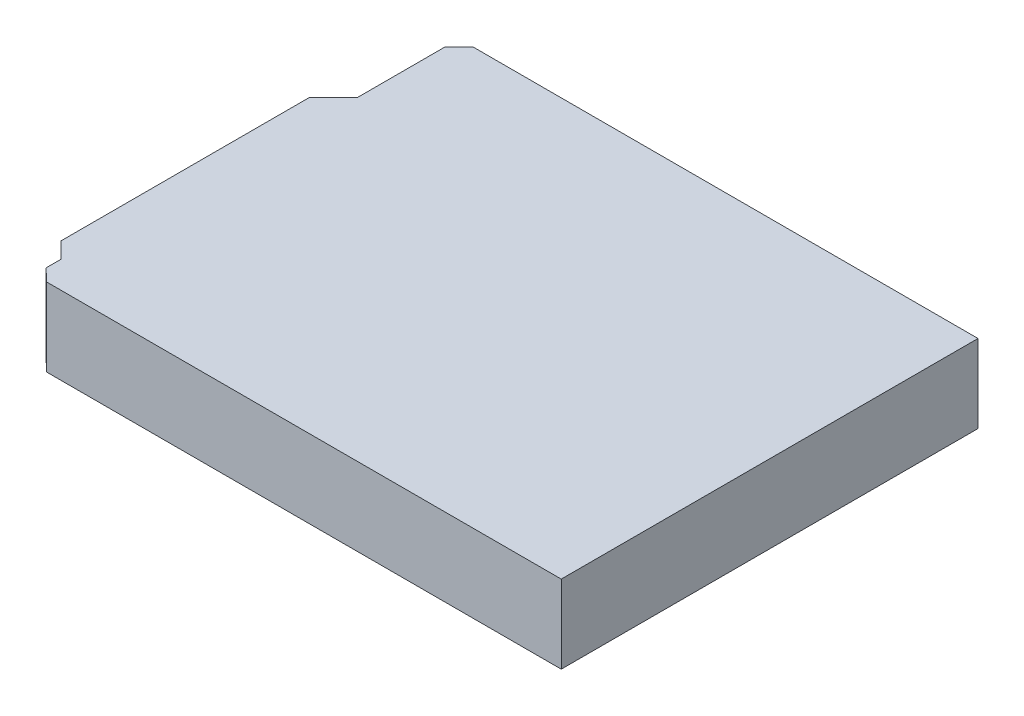
from build123d import *

# Parameters (mm, degrees)
BOSS_EXTRUDE1_DEPTH = 10


with BuildPart() as part:
    # Sketch1 → Boss-Extrude1 (new body)
    with BuildSketch(Plane(origin=(0, 0, 0), x_dir=(1, 0, 0), z_dir=(0, 1, 0))):
        Polygon((-28.591191439, 26.258510838), (-30.358958392, 24.490743885), (-30.358958392, 13.260743885), (-33.441943958, 10.177758319), (-33.441943958, -21.652241681), (-31.401418564, -23.692767075), (-31.401418564, -25.622767075), (-29.791191439, -27.141489162), (36.138808561, -27.141489162), (36.138808561, 26.258510838), align=None)
    extrude(amount=BOSS_EXTRUDE1_DEPTH)


solid = part.part
